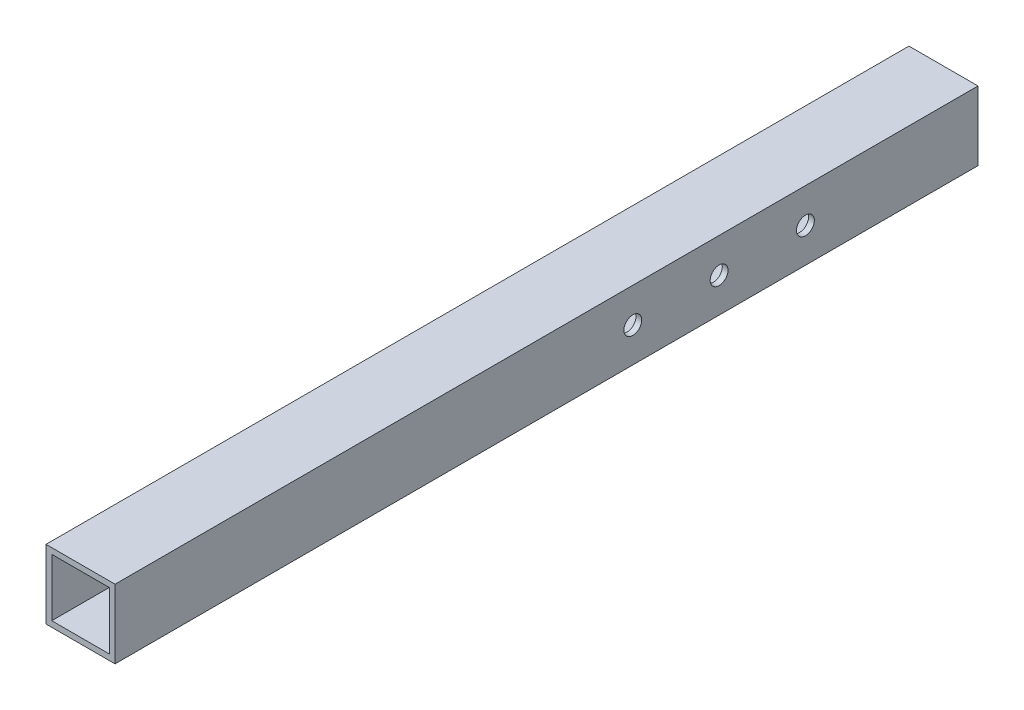
from build123d import *

# Parameters (mm, degrees)
SKETCH_1_W          = 12
SKETCH_1_H          = 12
SKETCH_1_W_2        = 10
SKETCH_1_H_2        = 10
EXTRUDE_1_DEPTH     = 150
SKETCH_3_R          = 1.55
CUT_EXTRUDE_1_DEPTH = 151.956947505


with BuildPart() as part:
    # 草图1 → 凸台-拉伸1 (new body)
    with BuildSketch(Plane.XY):
        with Locations((6, 6)):
            Rectangle(SKETCH_1_W, SKETCH_1_H)
        with Locations((6, 6)):
            Rectangle(SKETCH_1_W_2, SKETCH_1_H_2, mode=Mode.SUBTRACT)
    extrude(amount=EXTRUDE_1_DEPTH)

    # 草图3 → 切除-拉伸1 (cut, through all)
    with BuildSketch(Plane.YZ.offset(12)):
        with Locations(Location((6, 30, 0), (0, 0, 270))):
            Circle(SKETCH_3_R)
        with Locations(Location((6, 45, 0), (0, 0, 270))):
            Circle(SKETCH_3_R)
        with Locations(Location((6, 60, 0), (0, 0, 270))):
            Circle(SKETCH_3_R)
    extrude(amount=-CUT_EXTRUDE_1_DEPTH, mode=Mode.SUBTRACT)


solid = part.part
